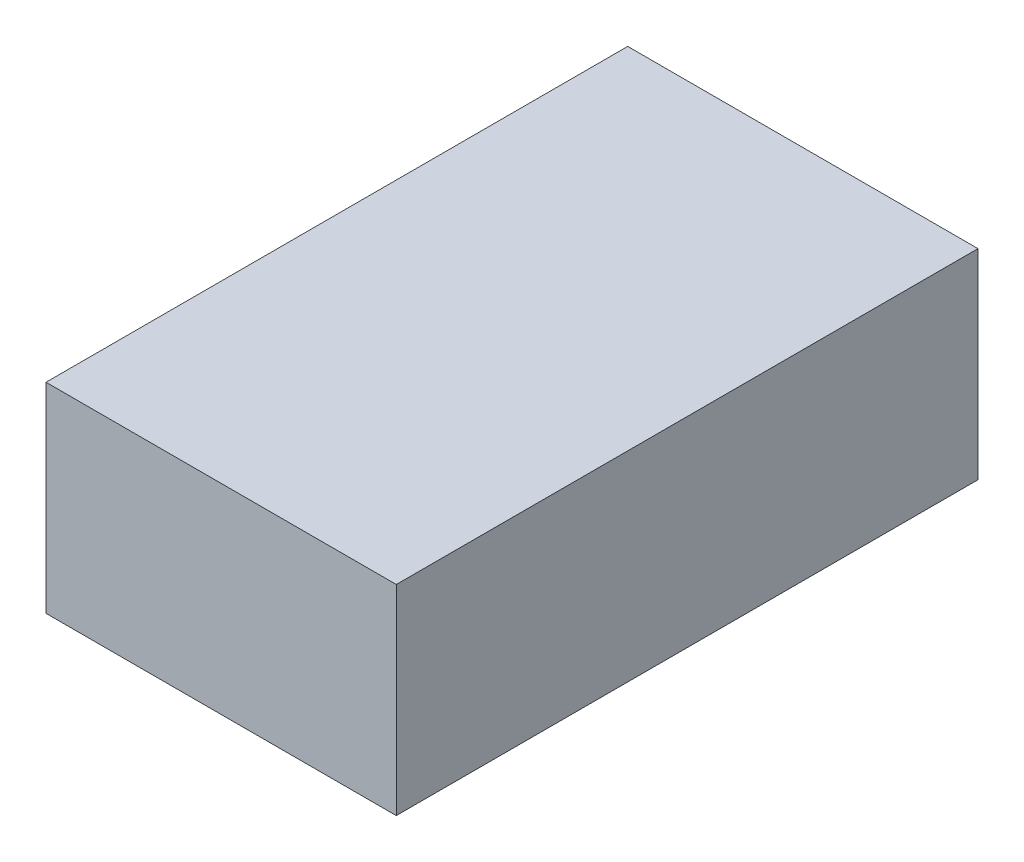
from build123d import *

# Parameters (mm, degrees)
SK_BOX_0_W  = 56
SK_BOX_0_H  = 32
BOX_0_DEPTH = 93


with BuildPart() as part:
    # SK_Box_0 → Box_0 (new body)
    with BuildSketch(Plane.XY.offset(100)):
        with Locations((-38, 62)):
            Rectangle(SK_BOX_0_W, SK_BOX_0_H)
    extrude(amount=BOX_0_DEPTH)


solid = part.part
